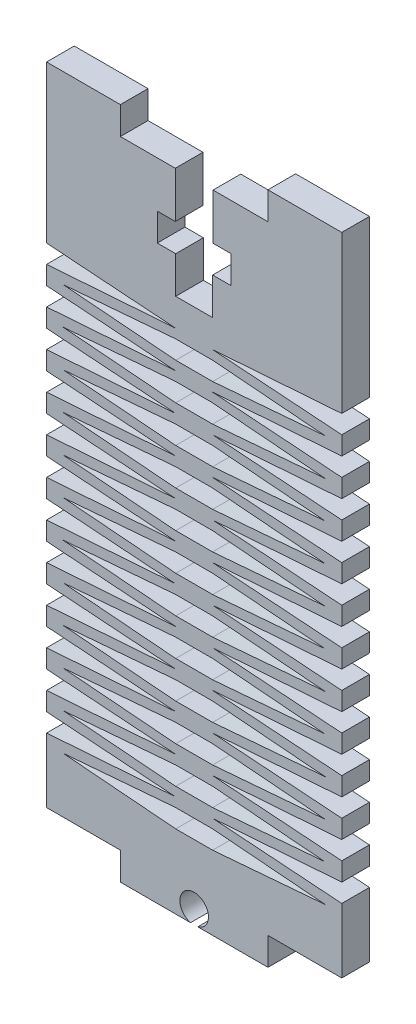
from build123d import *

# Parameters (mm, degrees)
EXTRUDE_1_DEPTH = 3


with BuildPart() as part:
    # 草图2 → 凸台-拉伸1 (new body)
    with BuildSketch(Plane.XY):
        with BuildLine():
            Line((2.047890023, 48.855305477), (8, 48.855305477))
            Line((8, 48.855305477), (8, 51.855305477))
            Line((8, 51.855305477), (16, 51.855305477))
            Line((16, 51.855305477), (16, 34.855305477))
            Line((16, 34.855305477), (2, 33.855305477))
            Line((2, 33.855305477), (16, 32.855305477))
            Line((16, 32.855305477), (16, 30.855305477))
            Line((16, 30.855305477), (2, 29.855305477))
            Line((2, 29.855305477), (16, 28.855305477))
            Line((16, 28.855305477), (16, 26.855305477))
            Line((16, 26.855305477), (2, 25.855305477))
            Line((2, 25.855305477), (16, 24.855305477))
            Line((16, 24.855305477), (16, 22.855305477))
            Line((16, 22.855305477), (2, 21.855305477))
            Line((2, 21.855305477), (16, 20.855305477))
            Line((16, 20.855305477), (16, 18.855305477))
            Line((16, 18.855305477), (2, 17.855305477))
            Line((2, 17.855305477), (16, 16.855305477))
            Line((16, 16.855305477), (16, 14.855305477))
            Line((16, 14.855305477), (2, 13.855305477))
            Line((2, 13.855305477), (16, 12.855305477))
            Line((16, 12.855305477), (16, 10.855305477))
            Line((16, 10.855305477), (2, 9.855305477))
            Line((2, 9.855305477), (16, 8.855305477))
            Line((16, 8.855305477), (16, 6.855305477))
            Line((16, 6.855305477), (2, 5.855305477))
            Line((2, 5.855305477), (16, 4.855305477))
            Line((16, 4.855305477), (16, 2.855305477))
            Line((16, 2.855305477), (2, 1.855305477))
            Line((2, 1.855305477), (16, 0.855305477))
            Line((16, 0.855305477), (16, -1.144694523))
            Line((16, -1.144694523), (2, -2.144694523))
            Line((2, -2.144694523), (16, -3.144694523))
            Line((16, -3.144694523), (16, -5.144694523))
            Line((16, -5.144694523), (2, -6.144694523))
            Line((2, -6.144694523), (16, -7.144694523))
            Line((16, -7.144694523), (16, -9.144694523))
            Line((16, -9.144694523), (2, -10.144694523))
            Line((2, -10.144694523), (16, -11.144694523))
            Line((16, -11.144694523), (16, -18.144694523))
            Line((16, -18.144694523), (8, -18.144694523))
            Line((8, -18.144694523), (8, -21.144694523))
            Line((8, -21.144694523), (0.390512484, -21.144694523))
            ThreePointArc((0.390512484, -21.144694523), (0, -18.094694523), (-0.390512484, -21.144694523))
            Line((-0.390512484, -21.144694523), (-8, -21.144694523))
            Line((-8, -21.144694523), (-8, -18.144694523))
            Line((-8, -18.144694523), (-16, -18.144694523))
            Line((-16, -18.144694523), (-16, -11.144694523))
            Line((-16, -11.144694523), (-2, -10.144694523))
            Line((-2, -10.144694523), (-16, -9.144694523))
            Line((-16, -9.144694523), (-16, -7.144694523))
            Line((-16, -7.144694523), (-2, -6.144694523))
            Line((-2, -6.144694523), (-16, -5.144694523))
            Line((-16, -5.144694523), (-16, -3.144694523))
            Line((-16, -3.144694523), (-2, -2.144694523))
            Line((-2, -2.144694523), (-16, -1.144694523))
            Line((-16, -1.144694523), (-16, 0.855305477))
            Line((-16, 0.855305477), (-2, 1.855305477))
            Line((-2, 1.855305477), (-16, 2.855305477))
            Line((-16, 2.855305477), (-16, 4.855305477))
            Line((-16, 4.855305477), (-2, 5.855305477))
            Line((-2, 5.855305477), (-16, 6.855305477))
            Line((-16, 6.855305477), (-16, 8.855305477))
            Line((-16, 8.855305477), (-2, 9.855305477))
            Line((-2, 9.855305477), (-16, 10.855305477))
            Line((-16, 10.855305477), (-16, 12.855305477))
            Line((-16, 12.855305477), (-2, 13.855305477))
            Line((-2, 13.855305477), (-16, 14.855305477))
            Line((-16, 14.855305477), (-16, 16.855305477))
            Line((-16, 16.855305477), (-2, 17.855305477))
            Line((-2, 17.855305477), (-16, 18.855305477))
            Line((-16, 18.855305477), (-16, 20.855305477))
            Line((-16, 20.855305477), (-2, 21.855305477))
            Line((-2, 21.855305477), (-16, 22.855305477))
            Line((-16, 22.855305477), (-16, 24.855305477))
            Line((-16, 24.855305477), (-2, 25.855305477))
            Line((-2, 25.855305477), (-16, 26.855305477))
            Line((-16, 26.855305477), (-16, 28.855305477))
            Line((-16, 28.855305477), (-2, 29.855305477))
            Line((-2, 29.855305477), (-16, 30.855305477))
            Line((-16, 30.855305477), (-16, 32.855305477))
            Line((-16, 32.855305477), (-2, 33.855305477))
            Line((-2, 33.855305477), (-16, 34.855305477))
            Line((-16, 34.855305477), (-16, 51.855305477))
            Line((-16, 51.855305477), (-8, 51.855305477))
            Line((-8, 51.855305477), (-8, 48.855305477))
            Line((-8, 48.855305477), (-2.047890023, 48.855305477))
            Line((-2.047890023, 48.855305477), (-2.047890023, 43.855305477))
            Line((-2.047890023, 43.855305477), (-4, 43.855305477))
            Line((-4, 43.855305477), (-4, 40.855305477))
            Line((-4, 40.855305477), (-2, 40.855305477))
            Line((-2, 40.855305477), (-2, 36.855305477))
            Line((-2, 36.855305477), (2, 36.855305477))
            Line((2, 36.855305477), (2, 40.855305477))
            Line((2, 40.855305477), (4, 40.855305477))
            Line((4, 40.855305477), (4, 43.855305477))
            Line((4, 43.855305477), (2.047890023, 43.855305477))
            Line((2.047890023, 43.855305477), (2.047890023, 48.855305477))
        make_face()
        Polygon((-14.217878812, -12.144694523), (-2, -13.144694523), (2, -13.144694523), (14.217878812, -12.144694523), (2, -11.144694523), (-2, -11.144694523), align=None, mode=Mode.SUBTRACT)
        Polygon((2, 32.855305477), (14.217878812, 31.855305477), (2, 30.855305477), (-2, 30.855305477), (-14.217878812, 31.855305477), (-2, 32.855305477), align=None, mode=Mode.SUBTRACT)
        Polygon((2, 28.855305477), (14.217878812, 27.855305477), (2, 26.855305477), (-2, 26.855305477), (-14.217878812, 27.855305477), (-2, 28.855305477), align=None, mode=Mode.SUBTRACT)
        Polygon((2, 24.855305477), (14.217878812, 23.855305477), (2, 22.855305477), (-2, 22.855305477), (-14.217878812, 23.855305477), (-2, 24.855305477), align=None, mode=Mode.SUBTRACT)
        Polygon((2, 20.855305477), (14.217878812, 19.855305477), (2, 18.855305477), (-2, 18.855305477), (-14.217878812, 19.855305477), (-2, 20.855305477), align=None, mode=Mode.SUBTRACT)
        Polygon((2, 16.855305477), (14.217878812, 15.855305477), (2, 14.855305477), (-2, 14.855305477), (-14.217878812, 15.855305477), (-2, 16.855305477), align=None, mode=Mode.SUBTRACT)
        Polygon((2, 12.855305477), (14.217878812, 11.855305477), (2, 10.855305477), (-2, 10.855305477), (-14.217878812, 11.855305477), (-2, 12.855305477), align=None, mode=Mode.SUBTRACT)
        Polygon((2, 8.855305477), (14.217878812, 7.855305477), (2, 6.855305477), (-2, 6.855305477), (-14.217878812, 7.855305477), (-2, 8.855305477), align=None, mode=Mode.SUBTRACT)
        Polygon((2, 4.855305477), (14.217878812, 3.855305477), (2, 2.855305477), (-2, 2.855305477), (-14.217878812, 3.855305477), (-2, 4.855305477), align=None, mode=Mode.SUBTRACT)
        Polygon((2, 0.855305477), (14.217878812, -0.144694523), (2, -1.144694523), (-2, -1.144694523), (-14.217878812, -0.144694523), (-2, 0.855305477), align=None, mode=Mode.SUBTRACT)
        Polygon((2, -3.144694523), (14.217878812, -4.144694523), (2, -5.144694523), (-2, -5.144694523), (-14.217878812, -4.144694523), (-2, -3.144694523), align=None, mode=Mode.SUBTRACT)
        Polygon((2, -7.144694523), (14.217878812, -8.144694523), (2, -9.144694523), (-2, -9.144694523), (-14.217878812, -8.144694523), (-2, -7.144694523), align=None, mode=Mode.SUBTRACT)
    extrude(amount=EXTRUDE_1_DEPTH)


solid = part.part
